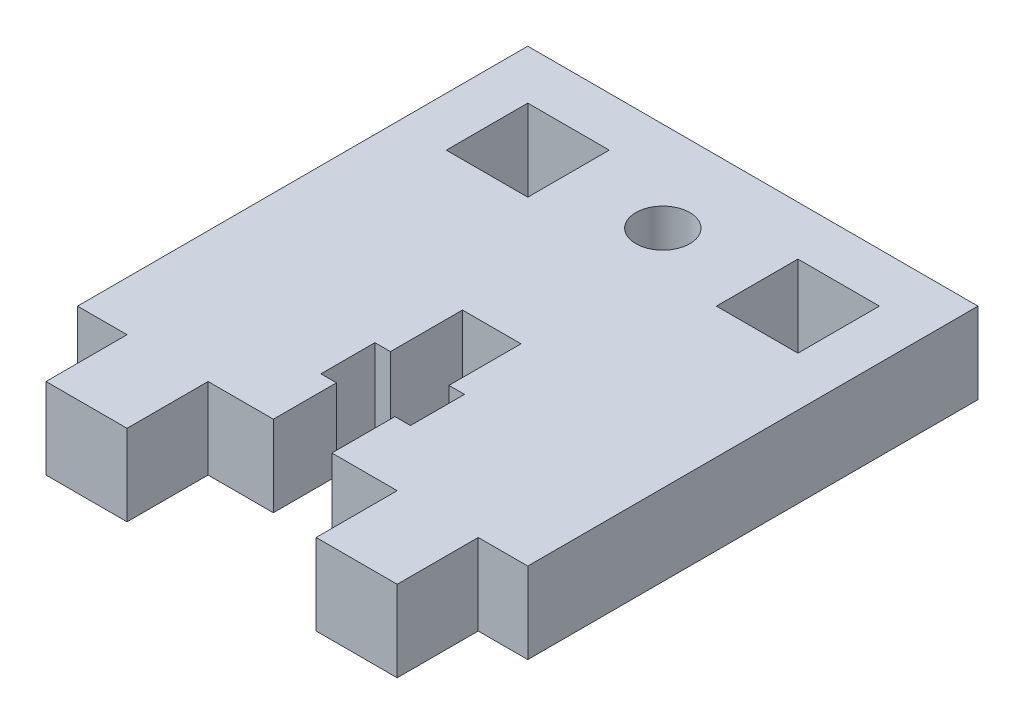
from build123d import *

# Parameters (mm, degrees)
SKETCH1_W           = 9.05
SKETCH1_H           = 9.05
SKETCH1_R           = 3
SKETCH1_W_2         = 9
SKETCH1_H_2         = 9
BOSS_EXTRUDE1_DEPTH = 9


with BuildPart() as part:
    # Sketch1 → Boss-Extrude1 (new body)
    # profile 1 of 3: a face of its own
    with BuildSketch(Plane(origin=(0, 0, 0), x_dir=(1, 0, 0), z_dir=(0, 1, 0))):
        Polygon((-25, 25), (-25, -25), (-19.5, -25), (-10.5, -25), (-3.25, -25), (-3.25, -18), (-4.975, -18), (-4.975, -12), (-3.25, -12), (-3.25, -4), (3.25, -4), (3.25, -12), (4.975, -12), (4.975, -18), (3.25, -18), (3.25, -25), (10.5, -25), (19.5, -25), (25, -25), (25, 25), align=None)
        with Locations((-15, 15)):
            Rectangle(SKETCH1_W, SKETCH1_H, mode=Mode.SUBTRACT)
        with Locations(Location((0, 15, 0), (0, 0, 270))):
            Circle(SKETCH1_R, mode=Mode.SUBTRACT)
        with Locations((15, 15)):
            Rectangle(SKETCH1_W, SKETCH1_H, mode=Mode.SUBTRACT)
    # profile 2 of 3: a face of its own
    with BuildSketch(Plane(origin=(0, 0, 0), x_dir=(1, 0, 0), z_dir=(0, 1, 0))):
        with Locations((-15, -29.5)):
            Rectangle(SKETCH1_W_2, SKETCH1_H_2)
    # profile 3 of 3: a face of its own
    with BuildSketch(Plane(origin=(0, 0, 0), x_dir=(1, 0, 0), z_dir=(0, 1, 0))):
        with Locations((15, -29.5)):
            Rectangle(SKETCH1_W_2, SKETCH1_H_2)
    extrude(amount=BOSS_EXTRUDE1_DEPTH)


solid = part.part
